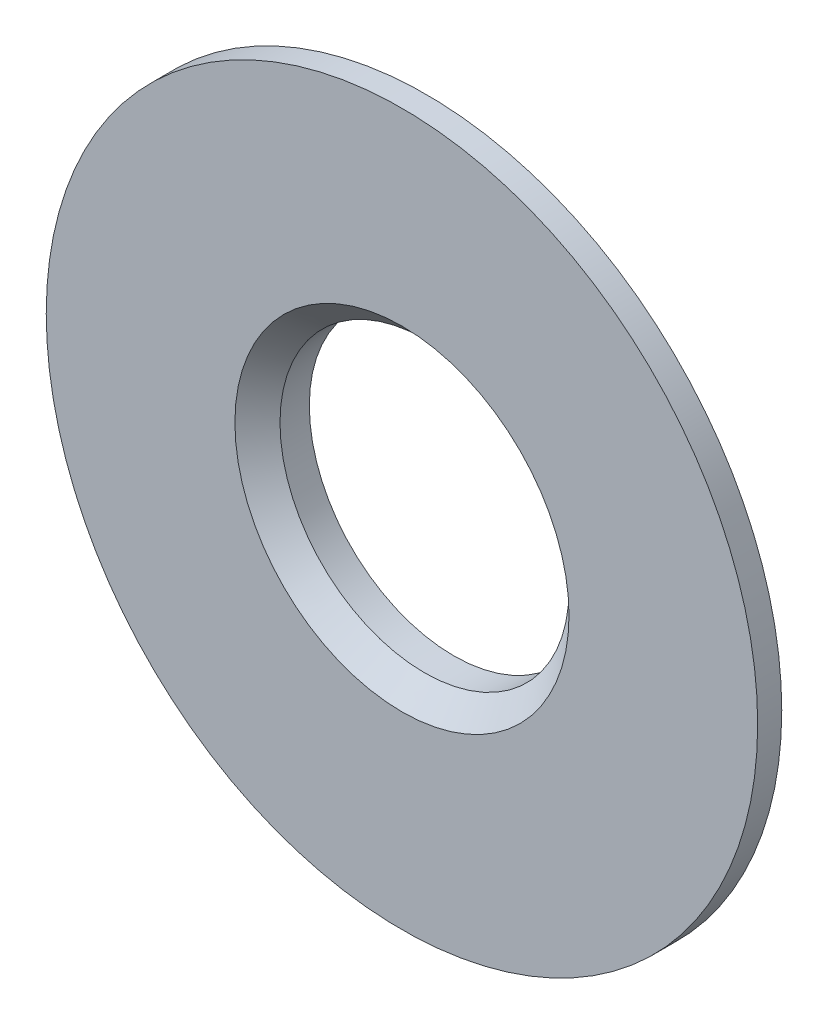
from build123d import *


with BuildPart() as part:
    # Sketch1 → Revolve-Thin1 (revolve)
    with BuildSketch(Plane(origin=(0, 0, 0), x_dir=(0, 0, -1), z_dir=(1, 0, 0)), mode=Mode.PRIVATE) as revolve_thin1_sk:
        Polygon((0, 16), (-3, 16), (-5.2, 18.2), (-5.2, 38), (-3, 38), (-3, 38.4), (-5.6, 38.4), (-5.6, 18.034314575), (-3.165685425, 15.6), (0, 15.6), align=None)
    revolve(revolve_thin1_sk.sketch.rotate(Axis((0, 0, 0), (0, 0, 1)), 90), axis=Axis((0, 0, 0), (0, 0, 1)))


solid = part.part
